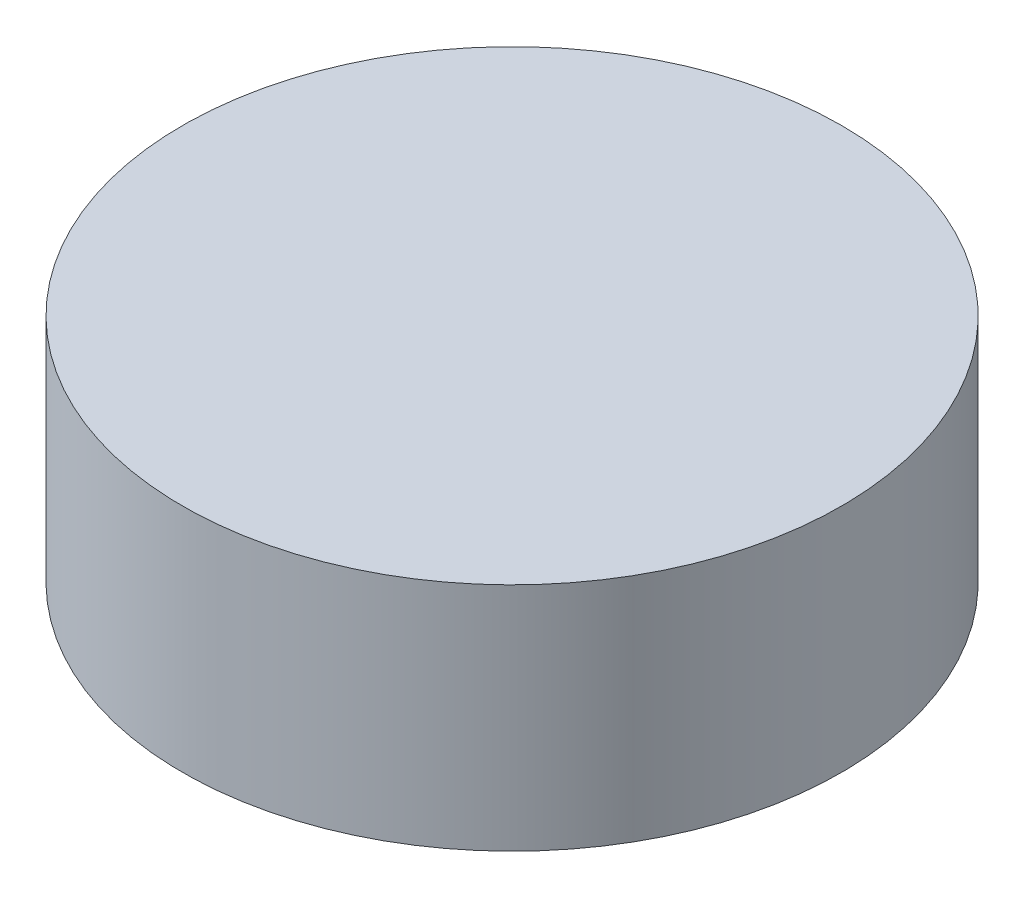
from build123d import *

# Parameters (mm, degrees)
SKTACOPVC1_R   = 20
TACOPVC1_DEPTH = 14


with BuildPart() as part:
    # SkTacoPVC1 → TacoPVC1 (new body)
    with BuildSketch(Plane(origin=(0, 18, 0), x_dir=(1, 0, 0), z_dir=(0, 1, 0))):
        with Locations(Location((150, 0, 0), (0, 0, 90))):
            Circle(SKTACOPVC1_R)
    extrude(amount=TACOPVC1_DEPTH)


solid = part.part
